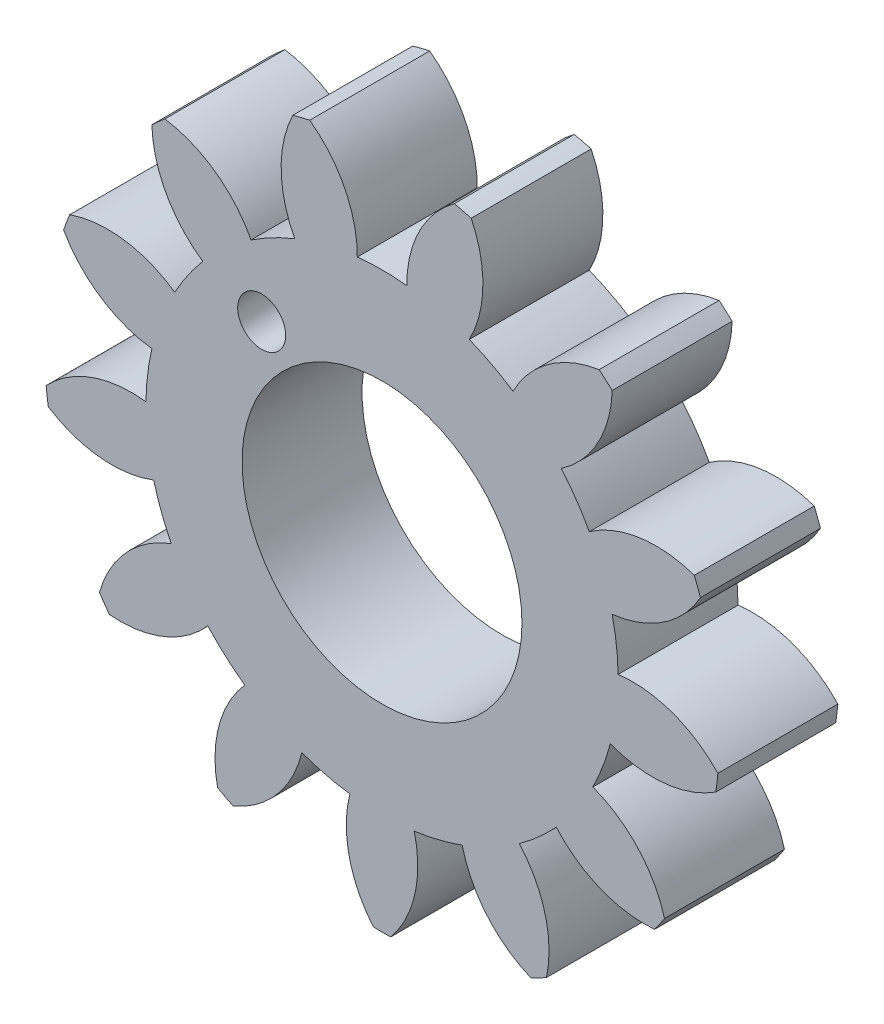
from build123d import *

# Parameters (mm, degrees)
SKETCH1_R           = 3.5
SKETCH1_R_2         = 0.6
BOSS_EXTRUDE1_DEPTH = 3


with BuildPart() as part:
    # Sketch1 → Boss-Extrude1 (new body)
    with BuildSketch(Plane.XY):
        with BuildLine():
            ThreePointArc((2.256436303, 18.02221908), (1.945672304, 19.349065897), (1.067466411, 20.391107713))
            ThreePointArc((1.067466411, 20.391107713), (0.855450056, 20.341742586), (0.644777778, 20.286924322))
            ThreePointArc((0.644777778, 20.286924322), (0.351426057, 18.956119489), (0.692874662, 17.636835748))
            ThreePointArc((0.692874662, 17.636835748), (0.130369461, 17.378260197), (-0.40197342, 17.062215148))
            ThreePointArc((-0.40197342, 17.062215148), (-1.293757737, 18.092660425), (-2.555631415, 18.607220002))
            ThreePointArc((-2.555631415, 18.607220002), (-2.720421456, 18.464980439), (-2.881487176, 18.318536988))
            ThreePointArc((-2.881487176, 18.318536988), (-2.522781382, 17.003840487), (-1.607341932, 15.994351828))
            ThreePointArc((-1.607341932, 15.994351828), (-1.985249501, 15.503985347), (-2.309742255, 14.976749281))
            ThreePointArc((-2.309742255, 14.976749281), (-3.57824985, 15.474730425), (-4.93471126, 15.343928364))
            ThreePointArc((-4.93471126, 15.343928364), (-5.014523575, 15.141399736), (-5.089084522, 14.936879527))
            ThreePointArc((-5.089084522, 14.936879527), (-4.160496386, 13.939472483), (-2.880782238, 13.471040593))
            ThreePointArc((-2.880782238, 13.471040593), (-2.987518106, 12.861220233), (-3.029823353, 12.243576579))
            ThreePointArc((-3.029823353, 12.243576579), (-4.384454423, 12.09501211), (-5.524754604, 11.348813588))
            ThreePointArc((-5.524754604, 11.348813588), (-5.501305152, 11.132392762), (-5.472280312, 10.916648911))
            ThreePointArc((-5.472280312, 10.916648911), (-4.186538186, 10.465025257), (-2.835716429, 10.644962236))
            ThreePointArc((-2.835716429, 10.644962236), (-2.646828694, 10.055390493), (-2.397254812, 9.488833969))
            ThreePointArc((-2.397254812, 9.488833969), (-3.527679704, 8.727758217), (-4.190589627, 7.537108322))
            ThreePointArc((-4.190589627, 7.537108322), (-4.069250395, 7.356374701), (-3.943289009, 7.178831524))
            ThreePointArc((-3.943289009, 7.178831524), (-2.594940919, 7.376452797), (-1.482468538, 8.163537251))
            ThreePointArc((-1.482468538, 8.163537251), (-1.041229104, 7.729277906), (-0.556950462, 7.343599785))
            ThreePointArc((-0.556950462, 7.343599785), (-1.204202457, 6.144366032), (-1.237857446, 4.782028306))
            ThreePointArc((-1.237857446, 4.782028306), (-1.046425791, 4.678385785), (-0.852384094, 4.579716284))
            ThreePointArc((-0.852384094, 4.579716284), (0.249679662, 5.381309833), (0.868948651, 6.595230199))
            ThreePointArc((0.868948651, 6.595230199), (1.461457147, 6.415766834), (2.069498148, 6.299321325))
            ThreePointArc((2.069498148, 6.299321325), (2.053696683, 4.936659572), (2.657006579, 3.714729171))
            ThreePointArc((2.657006579, 3.714729171), (2.874675973, 3.711921002), (3.092345367, 3.714729171))
            ThreePointArc((3.092345367, 3.714729171), (3.695655263, 4.936659572), (3.679853798, 6.299321325))
            ThreePointArc((3.679853798, 6.299321325), (4.2878948, 6.415766834), (4.880403295, 6.595230199))
            ThreePointArc((4.880403295, 6.595230199), (5.499672285, 5.381309833), (6.60173604, 4.579716284))
            ThreePointArc((6.60173604, 4.579716284), (6.795777737, 4.678385785), (6.987209392, 4.782028306))
            ThreePointArc((6.987209392, 4.782028306), (6.953554403, 6.144366032), (6.306302409, 7.343599785))
            ThreePointArc((6.306302409, 7.343599785), (6.790581051, 7.729277906), (7.231820484, 8.163537251))
            ThreePointArc((7.231820484, 8.163537251), (8.344292866, 7.376452797), (9.692640955, 7.178831524))
            ThreePointArc((9.692640955, 7.178831524), (9.818602342, 7.356374701), (9.939941573, 7.537108322))
            ThreePointArc((9.939941573, 7.537108322), (9.27703165, 8.727758217), (8.146606758, 9.488833969))
            ThreePointArc((8.146606758, 9.488833969), (8.39618064, 10.055390493), (8.585068375, 10.644962236))
            ThreePointArc((8.585068375, 10.644962236), (9.935890133, 10.465025257), (11.221632258, 10.916648911))
            ThreePointArc((11.221632258, 10.916648911), (11.250657098, 11.132392762), (11.27410655, 11.348813588))
            ThreePointArc((11.27410655, 11.348813588), (10.133806369, 12.09501211), (8.779175299, 12.243576579))
            ThreePointArc((8.779175299, 12.243576579), (8.736870052, 12.861220233), (8.630134184, 13.471040593))
            ThreePointArc((8.630134184, 13.471040593), (9.909848333, 13.939472483), (10.838436468, 14.936879527))
            ThreePointArc((10.838436468, 14.936879527), (10.763875521, 15.141399736), (10.684063206, 15.343928364))
            ThreePointArc((10.684063206, 15.343928364), (9.327601796, 15.474730425), (8.059094201, 14.976749281))
            ThreePointArc((8.059094201, 14.976749281), (7.734601447, 15.503985347), (7.356693878, 15.994351828))
            ThreePointArc((7.356693878, 15.994351828), (8.272133328, 17.003840487), (8.630839122, 18.318536988))
            ThreePointArc((8.630839122, 18.318536988), (8.469773402, 18.464980439), (8.304983361, 18.607220002))
            ThreePointArc((8.304983361, 18.607220002), (7.043109683, 18.092660425), (6.151325366, 17.062215148))
            ThreePointArc((6.151325366, 17.062215148), (5.618982485, 17.378260197), (5.056477284, 17.636835748))
            ThreePointArc((5.056477284, 17.636835748), (5.39792589, 18.956119489), (5.104574168, 20.286924322))
            ThreePointArc((5.104574168, 20.286924322), (4.893901891, 20.341742586), (4.681885535, 20.391107713))
            ThreePointArc((4.681885535, 20.391107713), (3.803679642, 19.349065897), (3.492915643, 18.02221908))
            ThreePointArc((3.492915643, 18.02221908), (2.874675973, 18.054671002), (2.256436303, 18.02221908))
        make_face()
        with Locations((2.874675973, 12.149421002)):
            Circle(SKETCH1_R, mode=Mode.SUBTRACT)
        with Locations((-0.135327396, 15.426977975)):
            Circle(SKETCH1_R_2, mode=Mode.SUBTRACT)
    extrude(amount=BOSS_EXTRUDE1_DEPTH)


solid = part.part
